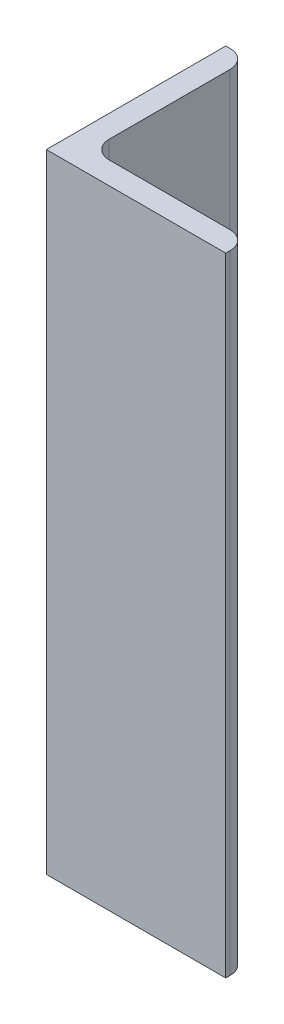
from build123d import *

# Parameters (mm, degrees)
BOSS_EXTRUDE1_DEPTH = 88.9


with BuildPart() as part:
    # Sketch1 → Boss-Extrude1 (new body)
    with BuildSketch(Plane(origin=(0, 0, 0), x_dir=(1, 0, 0), z_dir=(0, 1, 0))):
        with BuildLine():
            Line((0, 0), (0, 25.4))
            Line((0, 25.4), (0.635, 25.4))
            ThreePointArc((0.635, 25.4), (2.431051224, 24.656051224), (3.175, 22.86))
            Line((3.175, 22.86), (3.175, 5.715))
            ThreePointArc((3.175, 5.715), (3.918948776, 3.918948776), (5.715, 3.175))
            Line((5.715, 3.175), (22.86, 3.175))
            ThreePointArc((22.86, 3.175), (24.656051224, 2.431051224), (25.4, 0.635))
            Line((25.4, 0.635), (25.4, 0))
            Line((25.4, 0), (0, 0))
        make_face()
    extrude(amount=BOSS_EXTRUDE1_DEPTH)


solid = part.part
